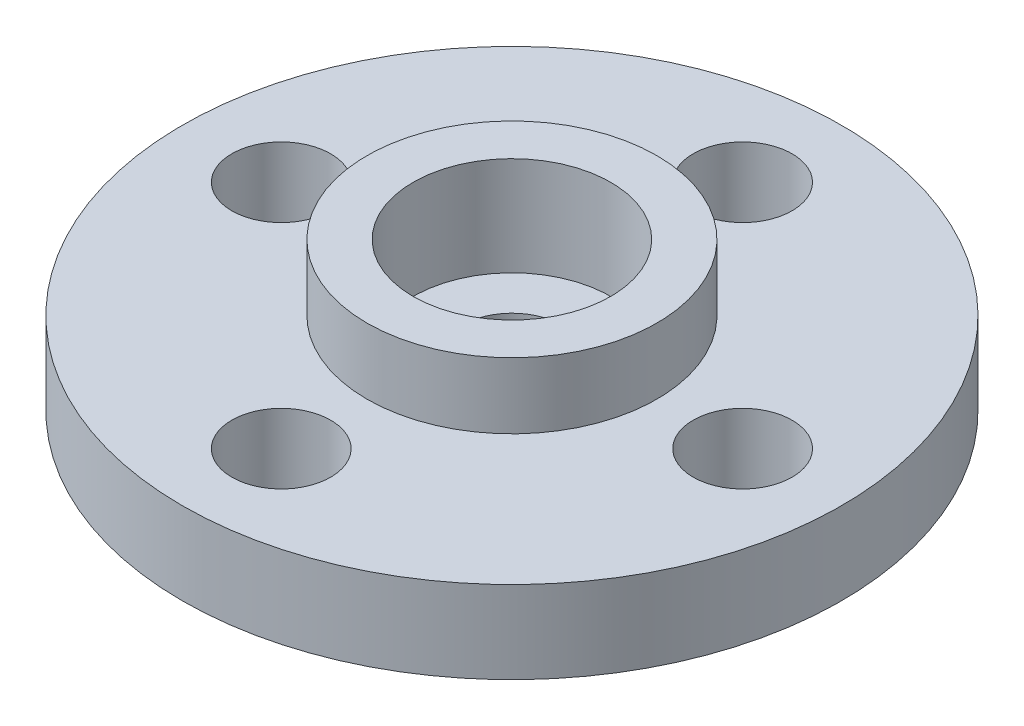
from build123d import *

# Parameters (mm, degrees)
SKETCH_4_R           = 10
EXTRUDE_2_DEPTH      = 2.5
SKETCH_6_R           = 1.5
CUT_EXTRUDE_9_DEPTH  = 2.5
SKETCH_7_R           = 4.4
EXTRUDE_3_DEPTH      = 2
SKETCH_8_R           = 3
CUT_EXTRUDE_10_DEPTH = 3


with BuildPart() as part:
    # 草图4 → 凸台-拉伸2 (new body)
    with BuildSketch(Plane(origin=(0, 0, 0), x_dir=(1, 0, 0), z_dir=(0, 1, 0))):
        Circle(SKETCH_4_R)
    extrude(amount=EXTRUDE_2_DEPTH)

    # 草图6 → 切除-拉伸9 (cut)
    with BuildSketch(Plane(origin=(0, 2.5, 0), x_dir=(1, 0, 0), z_dir=(0, 1, 0))):
        with Locations((0, 7)):
            Circle(SKETCH_6_R)
        Circle(SKETCH_6_R)
        with Locations((7, 0)):
            Circle(SKETCH_6_R)
        with Locations((-7, 0)):
            Circle(SKETCH_6_R)
        with Locations((0, -7)):
            Circle(SKETCH_6_R)
    extrude(amount=-CUT_EXTRUDE_9_DEPTH, mode=Mode.SUBTRACT)

    # 草图7 → 凸台-拉伸3 (add)
    with BuildSketch(Plane(origin=(0, 2.5, 0), x_dir=(1, 0, 0), z_dir=(0, 1, 0))):
        Circle(SKETCH_7_R)
    extrude(amount=EXTRUDE_3_DEPTH)

    # 草图8 → 切除-拉伸10 (cut)
    with BuildSketch(Plane(origin=(0, 4.5, 0), x_dir=(1, 0, 0), z_dir=(0, 1, 0))):
        Circle(SKETCH_8_R)
    extrude(amount=-CUT_EXTRUDE_10_DEPTH, mode=Mode.SUBTRACT)


solid = part.part
